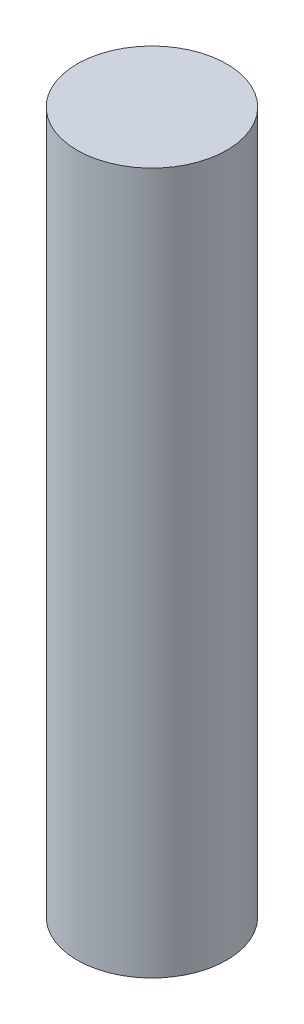
from build123d import *

# Parameters (mm, degrees)
ESBO_O1_R                = 1.6
RESSALTO_EXTRUS_O1_DEPTH = 15


with BuildPart() as part:
    # Esboço1 → Ressalto-extrusão1 (new body)
    with BuildSketch(Plane(origin=(0, 0, 0), x_dir=(1, 0, 0), z_dir=(0, 1, 0))):
        with Locations(Location((0, 0, 0), (0, 0, 270))):
            Circle(ESBO_O1_R)
    extrude(amount=RESSALTO_EXTRUS_O1_DEPTH)


solid = part.part
